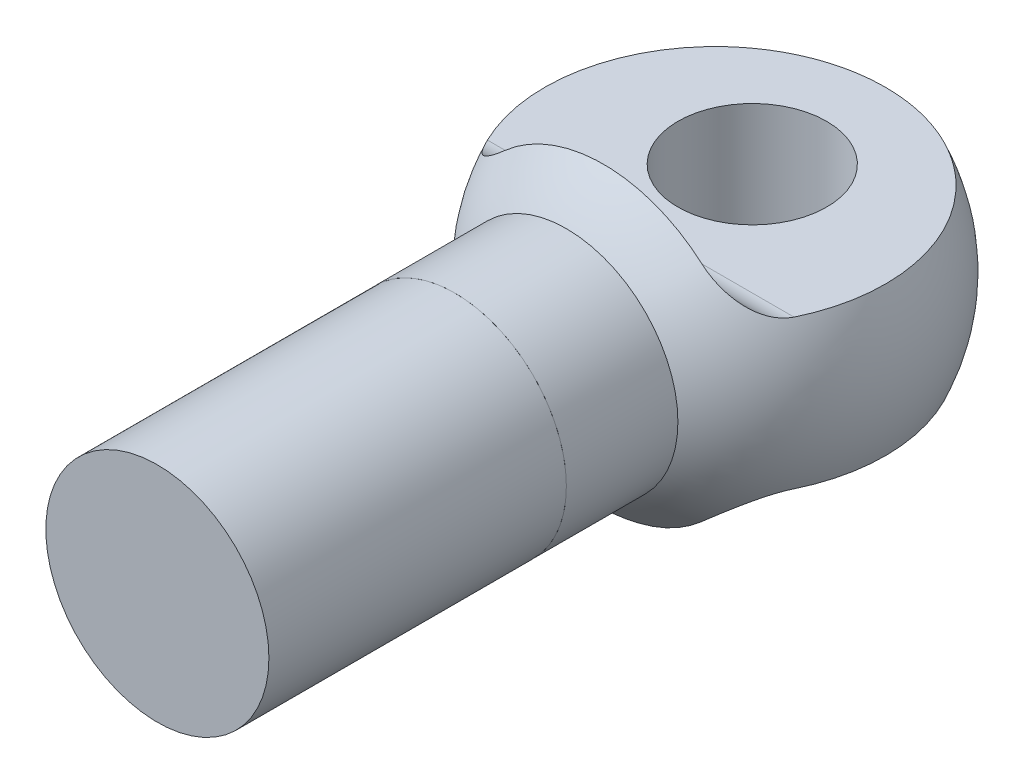
from build123d import *

# Parameters (mm, degrees)
CROQUIS1_R                 = 3
SALIENTE_EXTRUIR3_DEPTH    = 8
CROQUIS4_R                 = 3
SALIENTE_EXTRUIR5_DEPTH    = 3
CROQUIS7_W                 = 8
CROQUIS7_H                 = 3
CORTAR_EXTRUIR3_DEPTH      = 14.928388277
REDONDEO2_R                = 1
REDONDEO2_OF_SIMETR_A2_R   = 1
CORTAR_EXTRUIR4_DEPTH      = 14.601470538
CORTAR_EXTRUIR4_DEPTH_BACK = 14.601470538
CROQUIS8_R                 = 2


with BuildPart() as part:
    # Croquis1 → Saliente-Extruir3 (new body)
    with BuildSketch(Plane.XY):
        Circle(CROQUIS1_R)
    extrude(amount=SALIENTE_EXTRUIR3_DEPTH)


with BuildPart() as body_2:
    # Croquis4 → Saliente-Extruir5 (new body)
    with BuildSketch(Plane(origin=(0, 0, 0), x_dir=(-1, 0, 0), z_dir=(0, 0, -1))):
        Circle(CROQUIS4_R)
    extrude(amount=SALIENTE_EXTRUIR5_DEPTH)

    # Croquis5 → Revolución1 (revolve)
    with BuildSketch(Plane(origin=(0, 0, 0), x_dir=(1, 0, 0), z_dir=(0, 1, 0)), mode=Mode.PRIVATE) as revoluci_n1_sk:
        with BuildLine():
            Line((-3, 3), (0, 3))
            Line((0, 3), (0, 12))
            ThreePointArc((0, 12), (-4.74341649, 8.58113883), (-3, 3))
        make_face()
    revolve(revoluci_n1_sk.sketch.rotate(Axis((0, 0, 0), (0, 0, -1)), 180), axis=Axis((0, 0, 0), (0, 0, -1)))

    # Croquis7 → Cortar-Extruir3 (cut, symmetric)
    with BuildSketch(Plane(origin=(0, 0, 0), x_dir=(0, 0, -1), z_dir=(1, 0, 0))):
        with Locations((8, 3.5)):
            Rectangle(CROQUIS7_W, CROQUIS7_H)
    cortar_extruir3 = extrude(amount=CORTAR_EXTRUIR3_DEPTH, both=True, mode=Mode.SUBTRACT)

    # Redondeo2
    redondeo2_edges = [body_2.edges().sort_by_distance(p)[0] for p in [
        (0, 2, -4),
    ]]
    fillet(redondeo2_edges, radius=REDONDEO2_R)

    # Simetría2: Cortar-Extruir3 across plane
    add(cortar_extruir3.mirror(Plane.ZX), mode=Mode.SUBTRACT)

    # Redondeo2 of Simetría2
    redondeo2_of_simetr_a2_edges = [body_2.edges().sort_by_distance(p)[0] for p in [
        (0, -2, -4),
    ]]
    fillet(redondeo2_of_simetr_a2_edges, radius=REDONDEO2_OF_SIMETR_A2_R)

    # Croquis8 → Cortar-Extruir4 (cut, two sides: drawn at the far end of the back side and taken through both)
    with BuildSketch(Plane(origin=(0, 0, 0), x_dir=(1, 0, 0), z_dir=(0, 1, 0)).offset(-CORTAR_EXTRUIR4_DEPTH_BACK)):
        with Locations(Location((0, 8, 0), (0, 0, 90))):
            Circle(CROQUIS8_R)
    extrude(amount=CORTAR_EXTRUIR4_DEPTH + CORTAR_EXTRUIR4_DEPTH_BACK, mode=Mode.SUBTRACT)


solid = Compound([part.part, body_2.part])
